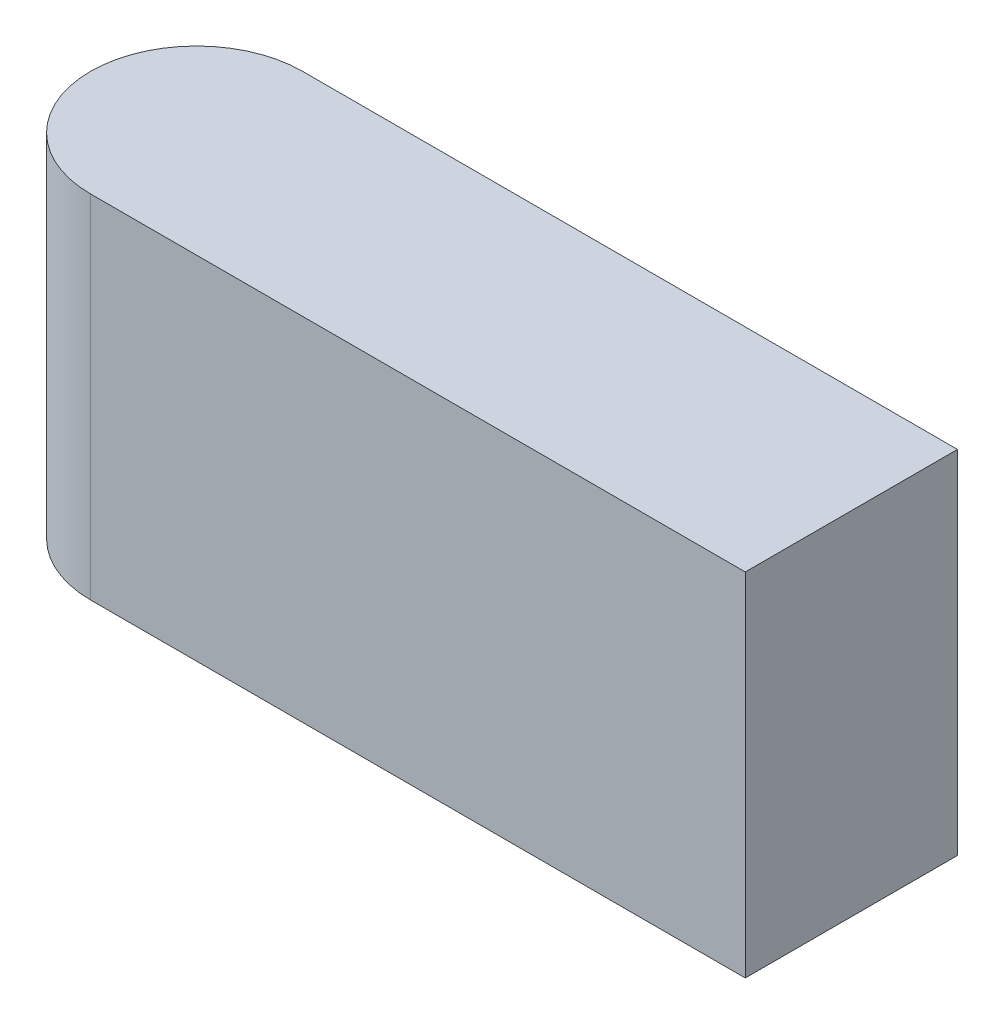
from build123d import *

# Parameters (mm, degrees)
BOSS_EXTRUDE1_DEPTH = 29


with BuildPart() as part:
    # Sketch1 → Boss-Extrude1 (new body)
    with BuildSketch(Plane(origin=(0, 0, 0), x_dir=(1, 0, 0), z_dir=(0, 1, 0))):
        with BuildLine():
            Line((0, 0), (54, 0))
            Line((54, 0), (54, 17.5))
            Line((54, 17.5), (0, 17.5))
            ThreePointArc((0, 17.5), (-8.75, 8.75), (0, 0))
        make_face()
    extrude(amount=BOSS_EXTRUDE1_DEPTH)


solid = part.part
